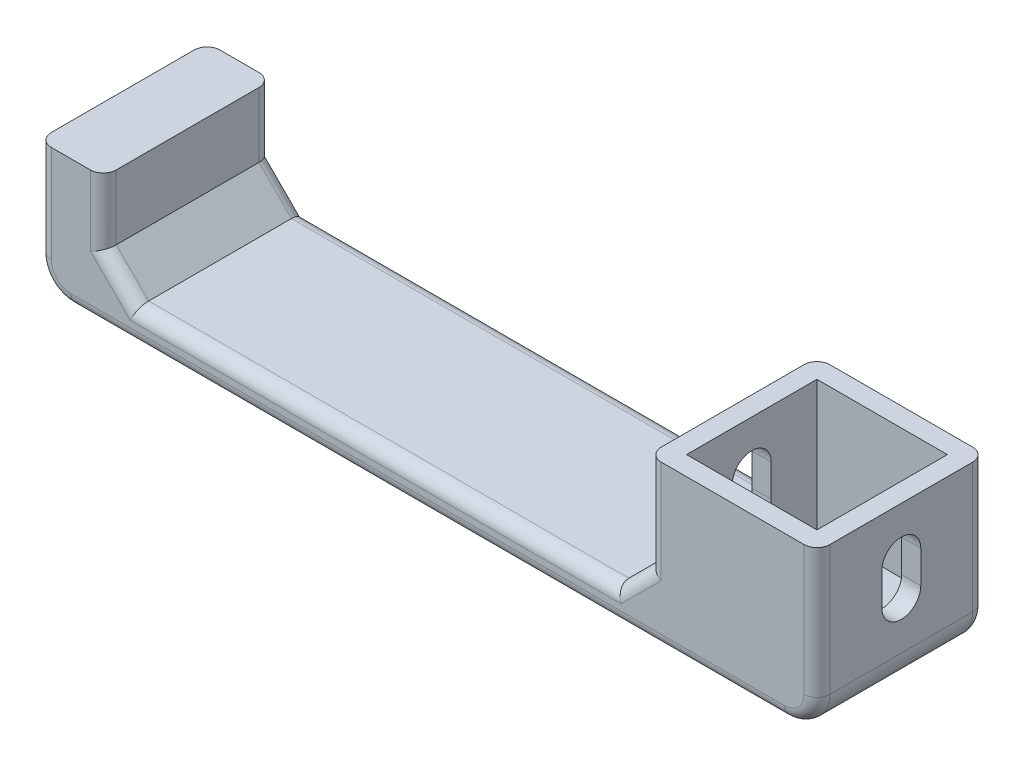
from build123d import *

# Parameters (mm, degrees)
SKETCH1_W           = 120
SKETCH1_H           = 26
BOSS_EXTRUDE1_DEPTH = 25
SKETCH3_W           = 84
SKETCH3_H           = 26
CUT_EXTRUDE1_DEPTH  = 20
SKETCH4_W           = 10
SKETCH4_H           = 26
CUT_EXTRUDE2_DEPTH  = 5
CHAMFER1_SIZE       = 5
SKETCH5_W           = 20.1
SKETCH5_H           = 20.1
CUT_EXTRUDE3_DEPTH  = 20
FILLET1_R           = 5
FILLET2_R           = 2
CUT_EXTRUDE4_DEPTH  = 30


with BuildPart() as part:
    # Sketch1 → Boss-Extrude1 (new body)
    with BuildSketch(Plane(origin=(0, 0, 0), x_dir=(1, 0, 0), z_dir=(0, 1, 0))):
        Rectangle(SKETCH1_W, SKETCH1_H)
    extrude(amount=BOSS_EXTRUDE1_DEPTH)

    # Sketch3 → Cut-Extrude1 (cut)
    with BuildSketch(Plane(origin=(0, 25, 0), x_dir=(1, 0, 0), z_dir=(0, 1, 0))):
        with Locations((-8, 0)):
            Rectangle(SKETCH3_W, SKETCH3_H)
    extrude(amount=-CUT_EXTRUDE1_DEPTH, mode=Mode.SUBTRACT)

    # Sketch4 → Cut-Extrude2 (cut)
    with BuildSketch(Plane(origin=(0, 25, 0), x_dir=(1, 0, 0), z_dir=(0, 1, 0))):
        with Locations((-55, 0)):
            Rectangle(SKETCH4_W, SKETCH4_H)
    extrude(amount=-CUT_EXTRUDE2_DEPTH, mode=Mode.SUBTRACT)

    # Chamfer1
    chamfer1_edges = [part.edges().sort_by_distance(p)[0] for p in [
        (-50, 5, 0),
        (34, 5, 0),
    ]]
    chamfer(chamfer1_edges, length=CHAMFER1_SIZE)

    # Sketch5 → Cut-Extrude3 (cut)
    with BuildSketch(Plane(origin=(0, 25, 0), x_dir=(1, 0, 0), z_dir=(0, 1, 0))):
        with Locations((47, 0)):
            Rectangle(SKETCH5_W, SKETCH5_H)
    extrude(amount=-CUT_EXTRUDE3_DEPTH, mode=Mode.SUBTRACT)

    # Fillet1
    fillet1_edges = [part.edges().sort_by_distance(p)[0] for p in [
        (60, 0, 0),
        (-60, 0, 0),
    ]]
    fillet(fillet1_edges, radius=FILLET1_R)

    # Fillet2
    fillet2_edges = [part.edges().sort_by_distance(p)[0] for p in [
        (-60, 12.5, -13),
        (-60, 12.5, 13),
        (-8, 5, 13),
        (-8, 5, -13),
        (-50, 15, 13),
        (-50, 15, -13),
        (34, 17.5, -13),
        (34, 17.5, 13),
        (-47.5, 7.5, 13),
        (-47.5, 7.5, -13),
        (31.5, 7.5, -13),
        (31.5, 7.5, 13),
        (0, 0, -13),
        (-58.535533906, 1.464466094, -13),
        (58.535533906, 1.464466094, -13),
        (0, 0, 13),
        (-58.535533906, 1.464466094, 13),
        (58.535533906, 1.464466094, 13),
        (60, 15, -13),
        (60, 15, 13),
    ]]
    fillet(fillet2_edges, radius=FILLET2_R)

    # Sketch6 → Cut-Extrude4 (cut)
    with BuildSketch(Plane(origin=(60, 0, 0), x_dir=(0, 0, -1), z_dir=(1, 0, 0))):
        with BuildLine():
            Line((3, 17.5), (3, 12.5))
            ThreePointArc((3, 12.5), (0, 9.5), (-3, 12.5))
            Line((-3, 12.5), (-3, 17.5))
            ThreePointArc((-3, 17.5), (0, 20.5), (3, 17.5))
        make_face()
    extrude(amount=-CUT_EXTRUDE4_DEPTH, mode=Mode.SUBTRACT)


solid = part.part
